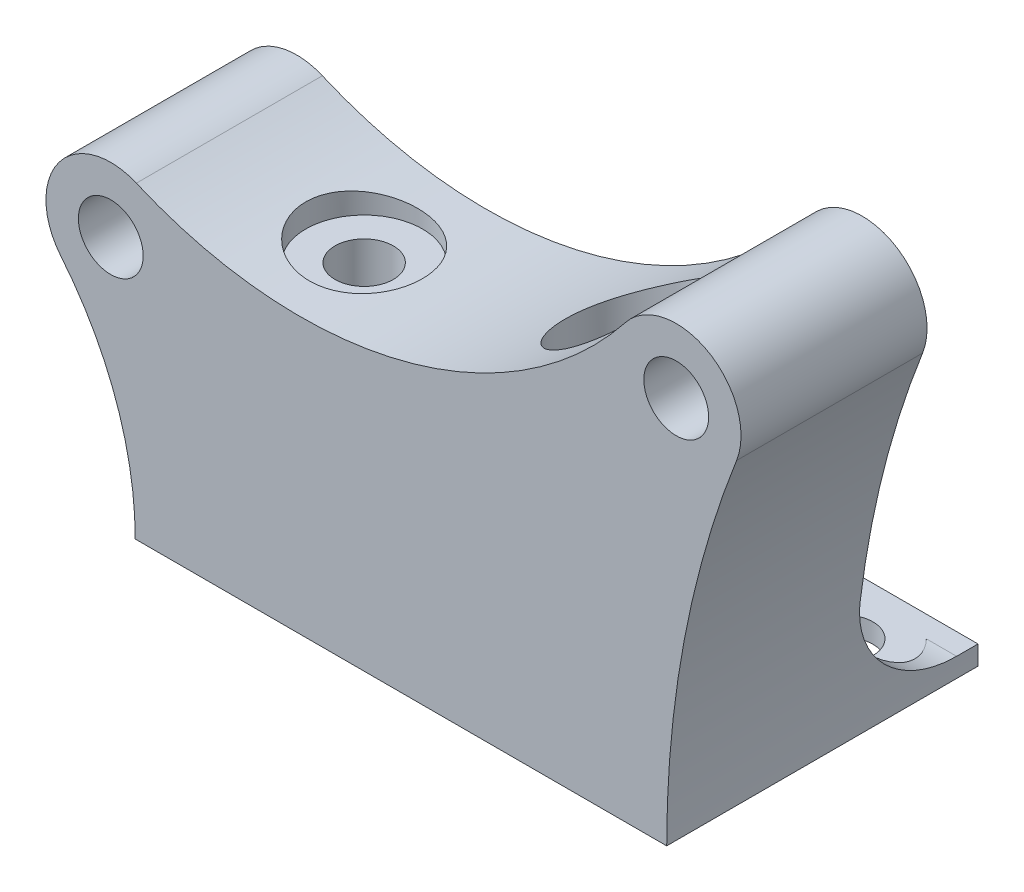
from build123d import *

# Parameters (mm, degrees)
SZKIC1_R                                            = 5
DODANIE_WYCI_GNI_CIE1_DEPTH                         = 28.7
DODANIE_WYCI_GNI_CIE2_REACH                         = 120.092
DODANIE_WYCI_GNI_CIE2_END_RADIUS                    = 50.543324632
WYTNIJ_WYCI_GNI_CIE1_START                          = -19.3
WYTNIJ_WYCI_GNI_CIE1_DEPTH                          = 19.3
POG_BIENIE_WALCOWE_POD_M8_WKR_T_Z_BEM_S_D           = 9
POG_BIENIE_WALCOWE_POD_M8_WKR_T_Z_BEM_S_CBORE_D     = 18.011
POG_BIENIE_WALCOWE_POD_M8_WKR_T_Z_BEM_S_CBORE_DEPTH = 20.3
POG_BIENIE_WALCOWE_POD_M8_WKR_T_Z_B_2_D             = 9
POG_BIENIE_WALCOWE_POD_M8_WKR_T_Z_B_2_CBORE_D       = 18.011
POG_BIENIE_WALCOWE_POD_M8_WKR_T_Z_B_2_CBORE_DEPTH   = 57.54


with BuildPart() as part:
    # Szkic1 → Dodanie-wyciągnięcie1 (new body)
    with BuildSketch(Plane.XY):
        with BuildLine():
            Line((-1.469986393, -60.54), (-83.469986393, -60.54))
            ThreePointArc((-83.469986393, -60.54), (-86.43214098, -43.49124867), (-94.971403209, -28.440824015))
            ThreePointArc((-94.971403209, -28.440824015), (-95.242829308, -16.084497343), (-83.300365534, -12.901724973))
            ThreePointArc((-83.300365534, -12.901724973), (-42.333721248, -16.139046942), (-7.843535904, 6.203139892))
            ThreePointArc((-7.843535904, 6.203139892), (4.984530504, 8.669166953), (9.306965288, -3.657922516))
            ThreePointArc((9.306965288, -3.657922516), (1.248004894, -31.593007814), (-1.469986393, -60.54))
        make_face()
        with Locations((-87.246959259, -22.09)):
            Circle(SZKIC1_R, mode=Mode.SUBTRACT)
        Circle(SZKIC1_R, mode=Mode.SUBTRACT)
    extrude(amount=DODANIE_WYCI_GNI_CIE1_DEPTH)

    # Dodanie-wyciągnięcie2: up to this cylinder (the profile starts outside it)
    dodanie_wyci_gni_cie2_end = Plane(origin=(-134.013311026, -60.54, -6.691691), z_dir=(0, 0, -1)) * Cylinder(DODANIE_WYCI_GNI_CIE2_END_RADIUS, 342.270649265, mode=Mode.PRIVATE)
    # Szkic3 → Dodanie-wyciągnięcie2 (add, up to the surface)
    with BuildSketch(Plane(origin=(0, 0, 0), x_dir=(0, 0, -1), z_dir=(1, 0, 0)), mode=Mode.PRIVATE) as dodanie_wyci_gni_cie2_sk1:
        with BuildLine():
            Line((0, -60.54), (0, -41.54))
            ThreePointArc((0, -41.54), (4.686291501, -52.853708499), (16, -57.54))
            Line((16, -57.54), (19.3, -57.54))
            Line((19.3, -57.54), (19.3, -60.54))
            Line((19.3, -60.54), (0, -60.54))
        make_face()
    dodanie_wyci_gni_cie2_tool1 = extrude(dodanie_wyci_gni_cie2_sk1.sketch, amount=-DODANIE_WYCI_GNI_CIE2_REACH, mode=Mode.PRIVATE) - dodanie_wyci_gni_cie2_end
    add(dodanie_wyci_gni_cie2_tool1.solids().sort_by_distance((0, -56.56965, -6.691691))[0])

    # Szkic4 → Wytnij-wyciągnięcie1 (cut)
    with BuildSketch(Plane.XY.offset(WYTNIJ_WYCI_GNI_CIE1_START)):
        with BuildLine():
            Line((-1.469986393, -60.54), (0, -60.54))
            Line((0, -60.54), (0, -41.54))
            Line((0, -41.54), (-0.304878126, -41.54))
            ThreePointArc((-0.304878126, -41.54), (-1.178436016, -51.022155217), (-1.469986393, -60.54))
        make_face()
    extrude(amount=WYTNIJ_WYCI_GNI_CIE1_DEPTH, mode=Mode.SUBTRACT)

    # Pog_bienie walcowe pod M8 Wkr_t z _bem s (through all)
    with Locations(Plane(origin=(0, 0, 0), x_dir=(1, 0, 0), z_dir=(0, 1, 0))):
        with Locations((-62.500071487, -14.35), (-22.500071487, -14.35)):
            CounterBoreHole(POG_BIENIE_WALCOWE_POD_M8_WKR_T_Z_BEM_S_D / 2, POG_BIENIE_WALCOWE_POD_M8_WKR_T_Z_BEM_S_CBORE_D / 2, POG_BIENIE_WALCOWE_POD_M8_WKR_T_Z_BEM_S_CBORE_DEPTH)

    # Pog_bienie walcowe pod M8 Wkr_t z _b 2 (through all)
    with Locations(Plane(origin=(0, 0, 0), x_dir=(1, 0, 0), z_dir=(0, 1, 0))):
        with Locations((-72.500071487, 9.65), (-12.500071487, 9.65)):
            CounterBoreHole(POG_BIENIE_WALCOWE_POD_M8_WKR_T_Z_B_2_D / 2, POG_BIENIE_WALCOWE_POD_M8_WKR_T_Z_B_2_CBORE_D / 2, POG_BIENIE_WALCOWE_POD_M8_WKR_T_Z_B_2_CBORE_DEPTH)


solid = part.part
